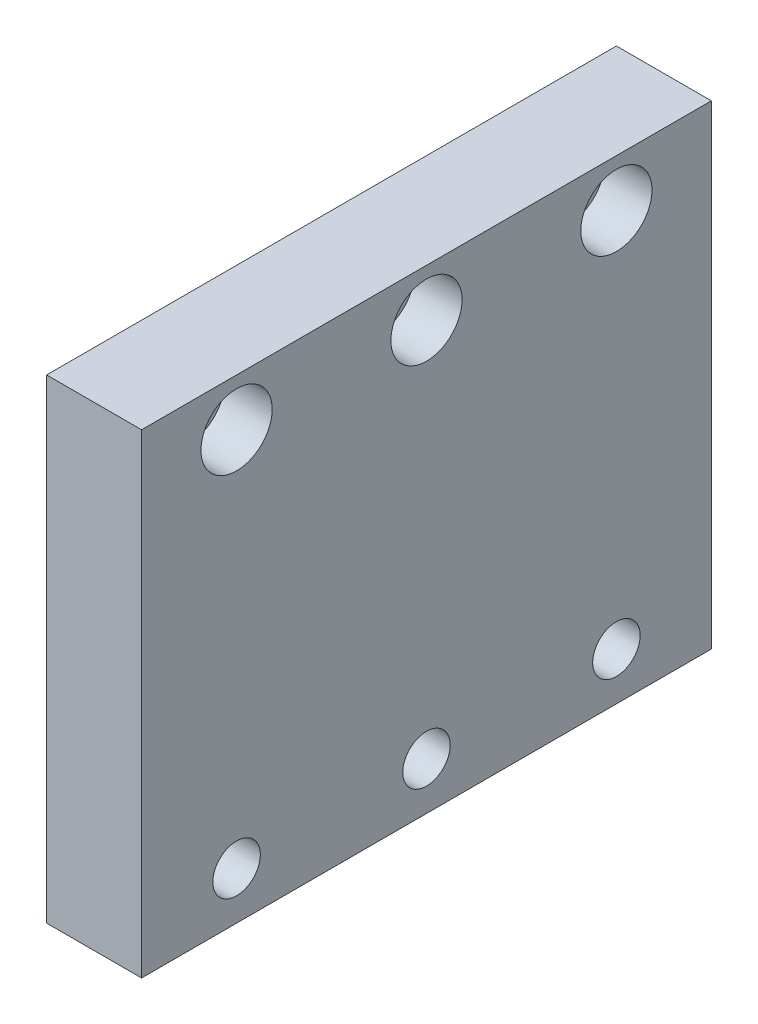
from build123d import *

# Parameters (mm, degrees)
BOSS_EXTRUDE1_DEPTH                           = 38.1
F_1_4_20_THREADED_C_BORE_D                    = 6.35
F_1_4_20_THREADED_C_BORE_CBORE_D              = 9.525
F_1_4_20_THREADED_C_BORE_CBORE_DEPTH          = 6.35
F_1_4_20_THREADED_C_BORE_OPPOSITE_D           = 6.35
F_1_4_20_THREADED_C_BORE_OPPOSITE_CBORE_D     = 9.525
F_1_4_20_THREADED_C_BORE_OPPOSITE_CBORE_DEPTH = 6.35


with BuildPart() as part:
    # Sketch2 → Boss-Extrude1 (new, symmetric)
    with BuildSketch(Plane.XY):
        Polygon((-6.35, 31.75), (6.35, 31.75), (6.35, -19.05), (6.35, -31.75), (-6.35, -31.75), (-6.35, 19.05), align=None)
    extrude(amount=BOSS_EXTRUDE1_DEPTH, both=True)

    # 1/4"-20 threaded c-bore (through all)
    with Locations(Plane.ZY.offset(6.35)):
        with Locations((-25.4, -25.4), (0, -25.4), (25.4, -25.4)):
            CounterBoreHole(F_1_4_20_THREADED_C_BORE_D / 2, F_1_4_20_THREADED_C_BORE_CBORE_D / 2, F_1_4_20_THREADED_C_BORE_CBORE_DEPTH)

    # 1/4"-20 threaded c-bore opposite (through all)
    with Locations(Plane(origin=(6.35, 0, 0), x_dir=(0, 0, -1), z_dir=(1, 0, 0))):
        with Locations((-25.4, 25.4), (0, 25.4), (25.4, 25.4)):
            CounterBoreHole(F_1_4_20_THREADED_C_BORE_OPPOSITE_D / 2, F_1_4_20_THREADED_C_BORE_OPPOSITE_CBORE_D / 2, F_1_4_20_THREADED_C_BORE_OPPOSITE_CBORE_DEPTH)


solid = part.part
